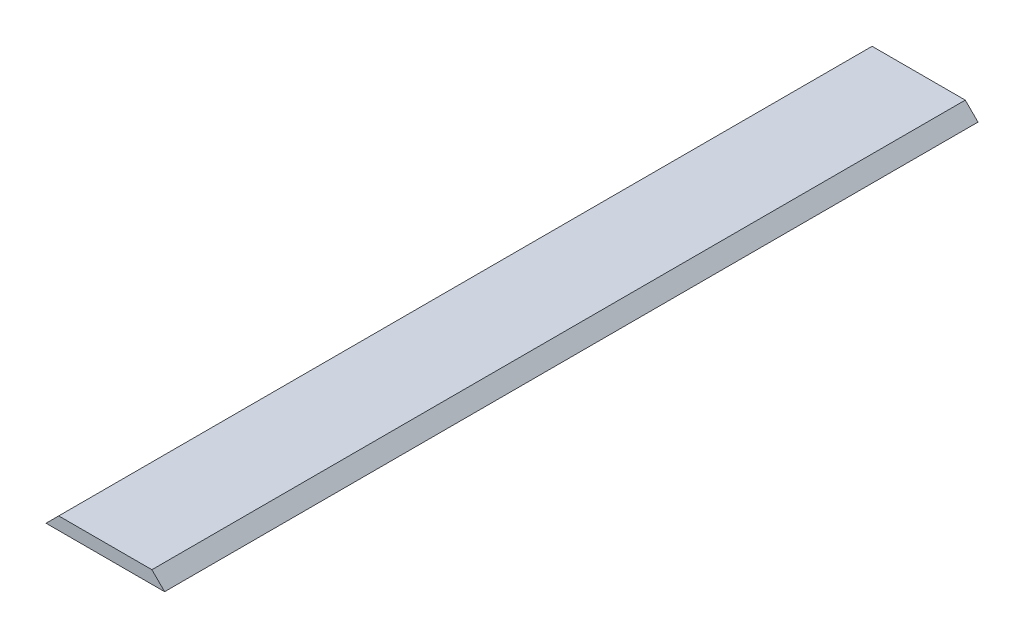
from build123d import *

# Parameters (mm, degrees)
SKETCH1_W           = 177.8
SKETCH1_H           = 19.05
BOSS_EXTRUDE1_DEPTH = 609.6
CUT_EXTRUDE1_DEPTH  = 1219.2


with BuildPart() as part:
    # Sketch1 → Boss-Extrude1 (new, symmetric)
    with BuildSketch(Plane.XY):
        Rectangle(SKETCH1_W, SKETCH1_H)
    extrude(amount=BOSS_EXTRUDE1_DEPTH, both=True)

    # Sketch2 → Cut-Extrude1 (cut)
    with BuildSketch(Plane.XY.offset(609.6)):
        Polygon((-88.9, -9.525), (-69.85, 9.525), (-88.9, 9.525), align=None)
        Polygon((88.9, 9.525), (69.85, 9.525), (88.9, -9.525), align=None)
    extrude(amount=-CUT_EXTRUDE1_DEPTH, mode=Mode.SUBTRACT)


solid = part.part
